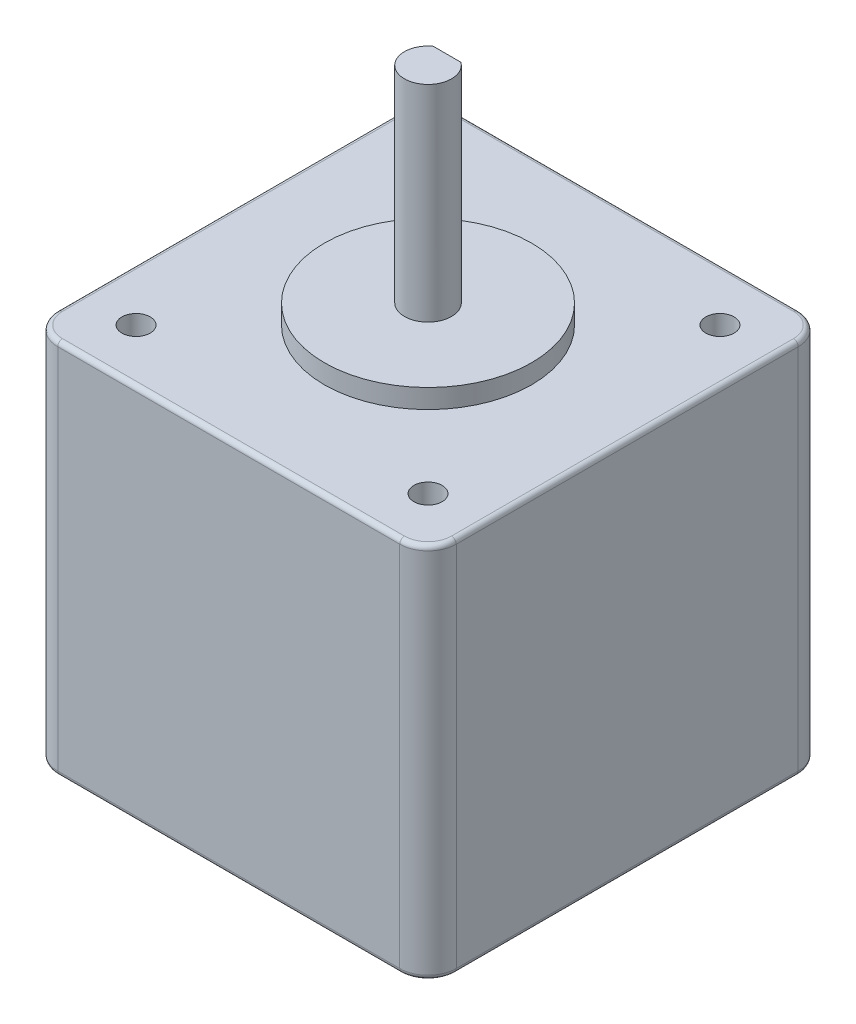
from build123d import *

# Parameters (mm, degrees)
SKETCH2_W           = 42.3
SKETCH2_H           = 42.3
SKETCH2_R           = 1.5
BOSS_EXTRUDE1_DEPTH = 40
SKETCH3_R           = 11
BOSS_EXTRUDE2_DEPTH = 2.03
SKETCH4_R           = 2.5
BOSS_EXTRUDE3_DEPTH = 21.85
CUT_EXTRUDE1_START  = -14.86
CUT_EXTRUDE1_DEPTH  = 14.86
FILLET1_R           = 3
FILLET2_R           = 0.5


with BuildPart() as part:
    # Sketch2 → Boss-Extrude1 (new body)
    with BuildSketch(Plane(origin=(0, 0, 0), x_dir=(1, 0, 0), z_dir=(0, 1, 0))):
        with Locations((21.15, 21.15)):
            Rectangle(SKETCH2_W, SKETCH2_H)
        with Locations(Location((5.655, 36.645, 0), (0, 0, 270))):
            Circle(SKETCH2_R, mode=Mode.SUBTRACT)
        with Locations(Location((36.645, 36.645, 0), (0, 0, 270))):
            Circle(SKETCH2_R, mode=Mode.SUBTRACT)
        with Locations(Location((36.645, 5.655, 0), (0, 0, 270))):
            Circle(SKETCH2_R, mode=Mode.SUBTRACT)
        with Locations(Location((5.655, 5.655, 0), (0, 0, 270))):
            Circle(SKETCH2_R, mode=Mode.SUBTRACT)
    extrude(amount=BOSS_EXTRUDE1_DEPTH)

    # Sketch3 → Boss-Extrude2 (add)
    with BuildSketch(Plane(origin=(0, 40, 0), x_dir=(1, 0, 0), z_dir=(0, 1, 0))):
        with Locations(Location((21.15, 21.15, 0), (0, 0, 270))):
            Circle(SKETCH3_R)
    extrude(amount=BOSS_EXTRUDE2_DEPTH)

    # Sketch4 → Boss-Extrude3 (add)
    with BuildSketch(Plane(origin=(0, 42.03, 0), x_dir=(1, 0, 0), z_dir=(0, 1, 0))):
        with Locations(Location((21.15, 21.15, 0), (0, 0, 270))):
            Circle(SKETCH4_R)
    extrude(amount=BOSS_EXTRUDE3_DEPTH)

    # Sketch5 → Cut-Extrude1 (cut)
    with BuildSketch(Plane(origin=(0, 63.88, 0), x_dir=(1, 0, 0), z_dir=(0, 1, 0)).offset(CUT_EXTRUDE1_START)):
        with BuildLine():
            Line((19.677043789, 23.17), (22.622956211, 23.17))
            ThreePointArc((22.622956211, 23.17), (21.15, 23.65), (19.677043789, 23.17))
        make_face()
    extrude(amount=CUT_EXTRUDE1_DEPTH, mode=Mode.SUBTRACT)

    # Fillet1
    fillet1_edges = [part.edges().sort_by_distance(p)[0] for p in [
        (0, 20, -42.3),
        (42.3, 20, -42.3),
        (42.3, 20, 0),
        (0, 20, 0),
    ]]
    fillet(fillet1_edges, radius=FILLET1_R)

    # Fillet2
    fillet2_edges = [part.edges().sort_by_distance(p)[0] for p in [
        (0, 0, -21.15),
        (0, 40, -21.15),
        (21.15, 0, -42.3),
        (42.3, 0, -21.15),
        (21.15, 0, 0),
        (0.878679656, 0, -0.878679656),
        (41.421320344, 0, -0.878679656),
        (41.421320344, 0, -41.421320344),
        (0.878679656, 0, -41.421320344),
        (21.15, 40, -42.3),
        (21.15, 40, 0),
        (42.3, 40, -21.15),
        (0.878679656, 40, -0.878679656),
        (41.421320344, 40, -0.878679656),
        (41.421320344, 40, -41.421320344),
        (0.878679656, 40, -41.421320344),
    ]]
    fillet(fillet2_edges, radius=FILLET2_R)


solid = part.part
